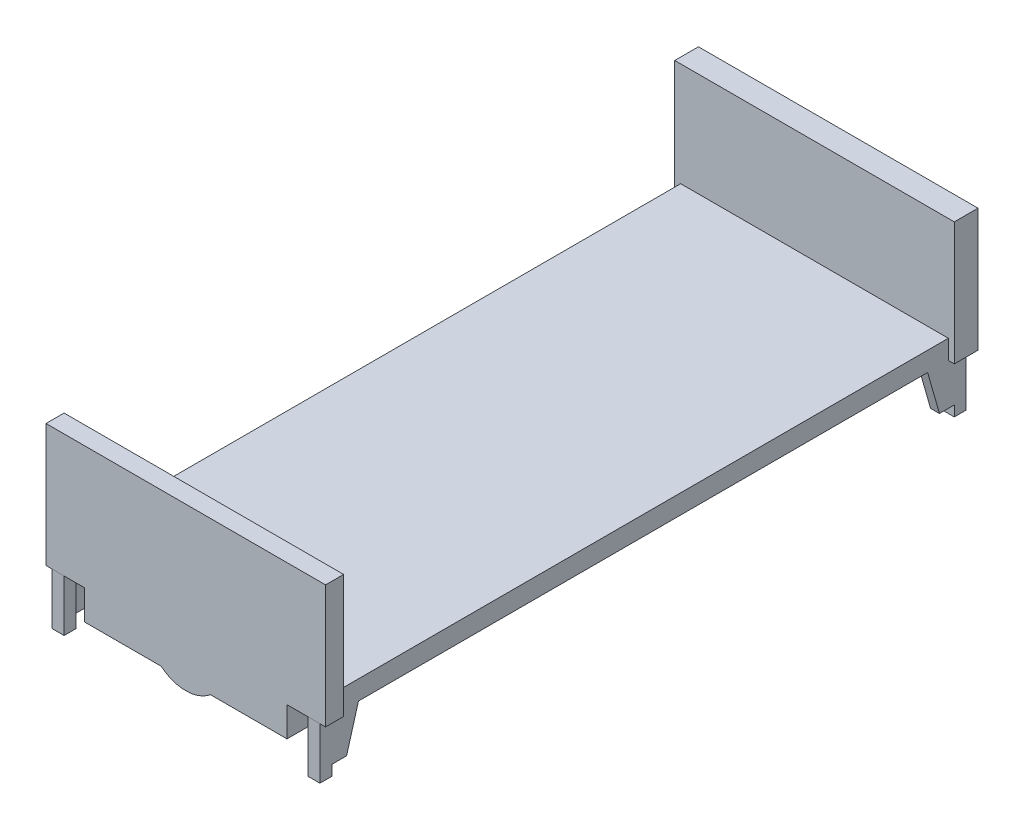
from build123d import *

# Parameters (mm, degrees)
BOSS_EXTRUDE1_DEPTH      = 65
BOSS_EXTRUDE2_DEPTH      = 350
BOSS_EXTRUDE2_DEPTH_BACK = 50
SKETCH1_3_W              = 943
SKETCH1_3_H              = 80
SKETCH1_3_H_2            = 61
SKETCH1_4_W              = 40
SKETCH1_4_H              = 40
BOSS_EXTRUDE3_DEPTH      = 240
BOSS_EXTRUDE4_DEPTH      = 30
BOSS_EXTRUDE5_DEPTH      = 30
SKETCH5_W                = 30
SKETCH5_H                = 30
CUT_EXTRUDE1_DEPTH       = 200
BOSS_EXTRUDE6_DEPTH      = 30
BOSS_EXTRUDE7_START      = -30
BOSS_EXTRUDE7_DEPTH      = 30
BOSS_EXTRUDE8_DEPTH      = 15
BOSS_EXTRUDE8_DEPTH_BACK = 15
SKETCH8_W                = 683
SKETCH8_H                = 420
BOSS_EXTRUDE9_DEPTH      = 100


with BuildPart() as part:
    # Sketch1 → Boss-Extrude1 (new body)
    with BuildSketch(Plane(origin=(0, 0, 0), x_dir=(1, 0, 0), z_dir=(0, 1, 0))):
        Polygon((-451.5, 60), (-471.5, 60), (-471.5, -1), (471.5, -1), (471.5, 60), (451.5, 60), (451.5, 2120), (471.5, 2120), (471.5, 2200), (-471.5, 2200), (-471.5, 2120), (-451.5, 2120), align=None)
    extrude(amount=-BOSS_EXTRUDE1_DEPTH)

    # Sketch1<3> → Boss-Extrude2 (add, two sides: drawn at the far end of the back side and taken through both)
    with BuildSketch(Plane(origin=(0, 0, 0), x_dir=(1, 0, 0), z_dir=(0, 1, 0)).offset(-BOSS_EXTRUDE2_DEPTH_BACK)):
        with Locations((0, 2160)):
            Rectangle(SKETCH1_3_W, SKETCH1_3_H)
        with Locations((0, 29.5)):
            Rectangle(SKETCH1_3_W, SKETCH1_3_H_2)
    extrude(amount=BOSS_EXTRUDE2_DEPTH + BOSS_EXTRUDE2_DEPTH_BACK)

    # Sketch1<4> → Boss-Extrude3 (add)
    with BuildSketch(Plane(origin=(0, 0, 0), x_dir=(1, 0, 0), z_dir=(0, 1, 0))):
        with Locations((-431.5, 20)):
            Rectangle(SKETCH1_4_W, SKETCH1_4_H)
        with Locations((431.5, 20)):
            Rectangle(SKETCH1_4_W, SKETCH1_4_H)
        with Locations((-431.5, 2160)):
            Rectangle(SKETCH1_4_W, SKETCH1_4_H)
        with Locations((431.5, 2160)):
            Rectangle(SKETCH1_4_W, SKETCH1_4_H)
    extrude(amount=-BOSS_EXTRUDE3_DEPTH)

    # Sketch3 → Boss-Extrude4 (add)
    with BuildSketch(Plane(origin=(451.5, 0, 0), x_dir=(0, 0, -1), z_dir=(1, 0, 0))):
        Polygon((40, -65), (40, -205), (90, -205), (130, -65), align=None)
        Polygon((2140, -65), (2050, -65), (2090, -205), (2140, -205), align=None)
    extrude(amount=-BOSS_EXTRUDE4_DEPTH)

    # Sketch4 → Boss-Extrude5 (add)
    with BuildSketch(Plane(origin=(-451.5, 0, -45.75), x_dir=(0, 0, -1), z_dir=(1, 0, 0))):
        Polygon((2044.25, -205), (2094.25, -205), (2094.25, -65), (2004.25, -65), align=None)
        Polygon((44.25, -205), (84.25, -65), (-5.75, -65), (-5.75, -205), align=None)
    extrude(amount=BOSS_EXTRUDE5_DEPTH)

    # Sketch5 → Cut-Extrude1 (cut)
    with BuildSketch(Plane.XZ.offset(240)):
        with Locations((-431.5, -2160)):
            Rectangle(SKETCH5_W, SKETCH5_H)
        with Locations((431.5, -2160)):
            Rectangle(SKETCH5_W, SKETCH5_H)
        with Locations((431.5, -20)):
            Rectangle(SKETCH5_W, SKETCH5_H)
        with Locations((-431.5, -20)):
            Rectangle(SKETCH5_W, SKETCH5_H)
    extrude(amount=-CUT_EXTRUDE1_DEPTH, mode=Mode.SUBTRACT)

    # Sketch6 → Boss-Extrude6 (add)
    with BuildSketch(Plane.XY.offset(1)):
        with BuildLine():
            Line((130, -65), (-130, -65))
            ThreePointArc((-130, -65), (0, -195), (130, -65))
        make_face()
    extrude(amount=-BOSS_EXTRUDE6_DEPTH)

    # Sketch7 → Boss-Extrude7 (add)
    with BuildSketch(Plane(origin=(0, 0, -2200), x_dir=(-1, 0, 0), z_dir=(0, 0, -1)).offset(BOSS_EXTRUDE7_START)):
        with BuildLine():
            Line((130, -65), (-130, -65))
            ThreePointArc((-130, -65), (0, -195), (130, -65))
        make_face()
    extrude(amount=BOSS_EXTRUDE7_DEPTH)

    # 3DSketch1 → Boss-Extrude8 (add, two sides: drawn at the far end of the back side and taken through both)
    with BuildSketch(Plane(origin=(0, -195, -29), x_dir=(0, 0.014010768487145287, -0.9999018443659355), z_dir=(1, 0, 0)).offset(-BOSS_EXTRUDE8_DEPTH_BACK)):
        Polygon((0, 0), (0.420323055, 29.997055331), (2141.210171842, 0), (2140.789848787, -29.997055331), align=None)
    extrude(amount=BOSS_EXTRUDE8_DEPTH + BOSS_EXTRUDE8_DEPTH_BACK)

    # Sketch8 → Boss-Extrude9 (add)
    with BuildSketch(Plane.XZ.offset(65)):
        with Locations((0, -209)):
            Rectangle(SKETCH8_W, SKETCH8_H)
    extrude(amount=BOSS_EXTRUDE9_DEPTH)


solid = part.part
